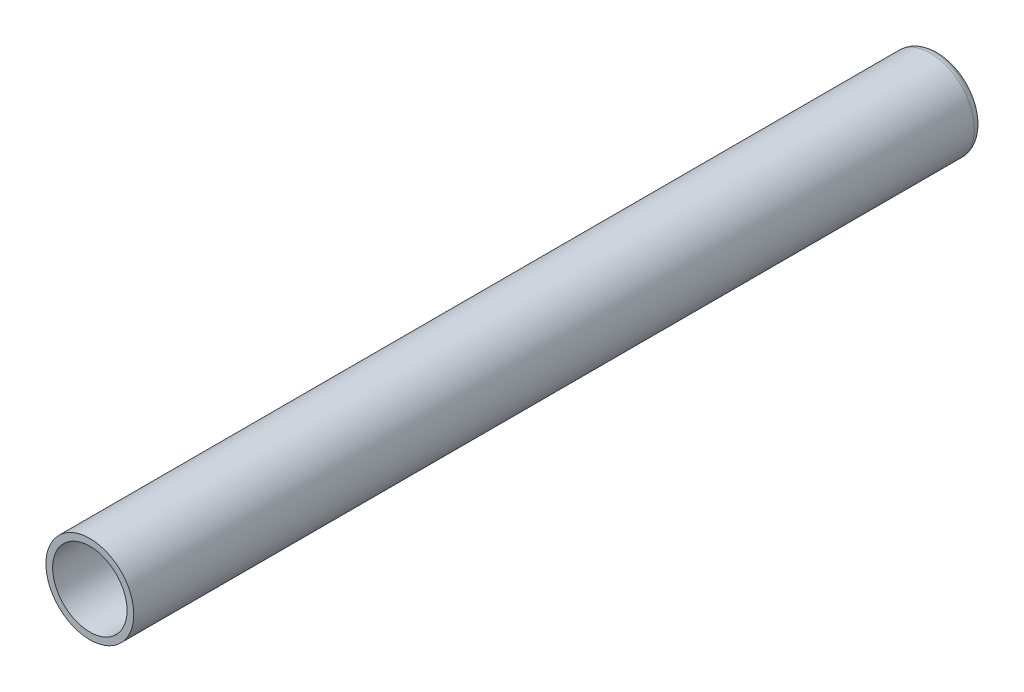
from build123d import *

# Parameters (mm, degrees)
CROQUIS2_R              = 15
SALIENTE_EXTRUIR1_DEPTH = 290
CROQUIS3_R              = 12.7
CORTAR_EXTRUIR1_DEPTH   = 282
REDONDEO1_R             = 3


with BuildPart() as part:
    # Croquis2 → Saliente-Extruir1 (new body)
    with BuildSketch(Plane.XY):
        Circle(CROQUIS2_R)
    extrude(amount=-SALIENTE_EXTRUIR1_DEPTH)

    # Croquis3 → Cortar-Extruir1 (cut)
    with BuildSketch(Plane.XY):
        Circle(CROQUIS3_R)
    extrude(amount=-CORTAR_EXTRUIR1_DEPTH, mode=Mode.SUBTRACT)

    # Redondeo1
    redondeo1_edges = [part.edges().sort_by_distance(p)[0] for p in [
        (-15, 0, -290),
    ]]
    fillet(redondeo1_edges, radius=REDONDEO1_R)


solid = part.part
